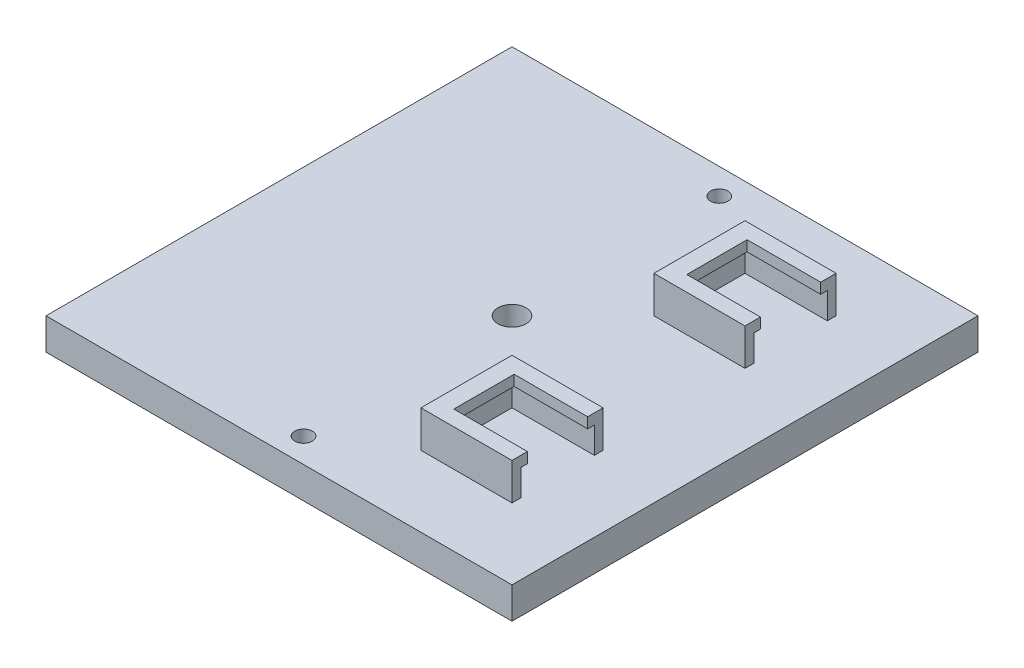
from build123d import *

# Parameters (mm, degrees)
SKETCH1_W            = 133
SKETCH1_H            = 133
BOSS_EXTRUDE2_DEPTH  = 136
SKETCH2_W            = 133
SKETCH2_H            = 118
CUT_EXTRUDE1_DEPTH   = 136
BOSS_EXTRUDE3_DEPTH  = 10.5
SKETCH5_W            = 21
SKETCH5_H            = 3
BOSS_EXTRUDE4_DEPTH  = 23.5
SKETCH6_W            = 42
SKETCH6_H            = 17.2
CUT_EXTRUDE2_DEPTH   = 3
BOSS_EXTRUDE5_DEPTH  = 10.5
SKETCH8_W            = 21
SKETCH8_H            = 3
BOSS_EXTRUDE6_DEPTH  = 23.5
SKETCH9_W            = 42
SKETCH9_H            = 17.2
CUT_EXTRUDE3_DEPTH   = 3
SKETCH10_W           = 19.261488562
SKETCH10_H           = 133
BOSS_EXTRUDE7_DEPTH  = 5
SKETCH11_W           = 18.43727499
SKETCH11_H           = 133
BOSS_EXTRUDE8_DEPTH  = 5
SKETCH12_W           = 18.849381776
SKETCH12_H           = 146
BOSS_EXTRUDE9_DEPTH  = 12
SKETCH14_W           = 18.849381776
SKETCH14_H           = 146
BOSS_EXTRUDE10_DEPTH = 12
SKETCH17_R           = 1
CUT_EXTRUDE4_DEPTH   = 222.251553667
SKETCH20_W           = 133.244561713
SKETCH20_H           = 5
CUT_EXTRUDE10_DEPTH  = 19
SKETCH21_W           = 157
SKETCH21_H           = 120.66580897
CUT_EXTRUDE11_DEPTH  = 118
SKETCH22_W           = 186.174267818
SKETCH22_H           = 42.2523161
CUT_EXTRUDE12_DEPTH  = 118
SKETCH23_W           = 12
SKETCH23_H           = 25.33419103
CUT_EXTRUDE13_DEPTH  = 118
SKETCH24_W           = 12
SKETCH24_H           = 25.33419103
CUT_EXTRUDE14_DEPTH  = 118
SKETCH31_R           = 2.5
CUT_EXTRUDE21_DEPTH  = 118
SKETCH32_R           = 2.5
CUT_EXTRUDE22_DEPTH  = 118
SKETCH33_W           = 133
SKETCH33_H           = 5
CUT_EXTRUDE24_DEPTH  = 118
SKETCH34_R           = 2.5
CUT_EXTRUDE25_DEPTH  = 118
SKETCH35_R           = 4
CUT_EXTRUDE26_DEPTH  = 10


with BuildPart() as part:
    # Sketch1 → Boss-Extrude2 (new body)
    with BuildSketch(Plane(origin=(0, 0, 0), x_dir=(1, 0, 0), z_dir=(0, 1, 0))):
        Rectangle(SKETCH1_W, SKETCH1_H)
    extrude(amount=BOSS_EXTRUDE2_DEPTH)

    # Sketch2 → Cut-Extrude1 (cut)
    with BuildSketch(Plane.XY.offset(66.5)):
        with Locations((0, 68)):
            Rectangle(SKETCH2_W, SKETCH2_H)
    extrude(amount=-CUT_EXTRUDE1_DEPTH, mode=Mode.SUBTRACT)


with BuildPart() as cut_extrude1_piece_1:
    # of the separate pieces the step leaves, piece 1, a body of its own (cut_extrude1_pieces)
    add(part.part.solids().sort_by_distance((-66.5, 0, 66.5))[0])

    # Sketch4 → Boss-Extrude3 (add)
    with BuildSketch(Plane(origin=(0, 9, 0), x_dir=(1, 0, 0), z_dir=(0, 1, 0))):
        Polygon((22.75, -22.75), (43.75, -22.75), (46.25, -22.75), (46.25, -20.25), (20.25, -20.25), (20.25, -46.25), (46.25, -46.25), (46.25, -43.75), (43.75, -43.75), (22.75, -43.75), align=None)
        Polygon((22.75, 43.75), (43.75, 43.75), (46.25, 43.75), (46.25, 46.25), (20.25, 46.25), (20.25, 20.25), (46.25, 20.25), (46.25, 22.75), (43.75, 22.75), (22.75, 22.75), align=None)
    extrude(amount=BOSS_EXTRUDE3_DEPTH)

    # Sketch5 → Boss-Extrude4 (add)
    with BuildSketch(Plane(origin=(22.75, 0, 0), x_dir=(0, 0, -1), z_dir=(1, 0, 0))):
        with Locations((-33.25, 18)):
            Rectangle(SKETCH5_W, SKETCH5_H)
        with Locations((33.25, 18)):
            Rectangle(SKETCH5_W, SKETCH5_H)
    extrude(amount=BOSS_EXTRUDE4_DEPTH)

    # Sketch6 → Cut-Extrude2 (cut)
    with BuildSketch(Plane(origin=(0, 19.5, 0), x_dir=(1, 0, 0), z_dir=(0, 1, 0))):
        with Locations((46.25, -33.25)):
            Rectangle(SKETCH6_W, SKETCH6_H)
        with Locations((46.25, 33.25)):
            Rectangle(SKETCH6_W, SKETCH6_H)
    extrude(amount=-CUT_EXTRUDE2_DEPTH, mode=Mode.SUBTRACT)

    # Sketch10 → Boss-Extrude7 (add)
    with BuildSketch(Plane.XZ):
        Rectangle(SKETCH10_W, SKETCH10_H)
    extrude(amount=BOSS_EXTRUDE7_DEPTH)



with BuildPart() as cut_extrude1_piece_2:
    # of the separate pieces the step leaves, piece 2, a body of its own (cut_extrude1_pieces)
    add(part.part.solids().sort_by_distance((66.5, 127, 66.5))[0])

    # Sketch7 → Boss-Extrude5 (add)
    with BuildSketch(Plane.XZ.offset(-127)):
        Polygon((-43.75, 43.75), (-22.75, 43.75), (-22.75, 22.75), (-43.75, 22.75), (-46.25, 22.75), (-46.25, 20.25), (-20.25, 20.25), (-20.25, 46.25), (-46.25, 46.25), (-46.25, 43.75), align=None)
        Polygon((-43.75, -22.75), (-22.75, -22.75), (-22.75, -43.75), (-43.75, -43.75), (-46.25, -43.75), (-46.25, -46.25), (-20.25, -46.25), (-20.25, -20.25), (-46.25, -20.25), (-46.25, -22.75), align=None)
    extrude(amount=BOSS_EXTRUDE5_DEPTH)

    # Sketch8 → Boss-Extrude6 (add)
    with BuildSketch(Plane.ZY.offset(22.75)):
        with Locations((33.25, 118)):
            Rectangle(SKETCH8_W, SKETCH8_H)
        with Locations((-33.25, 118)):
            Rectangle(SKETCH8_W, SKETCH8_H)
    extrude(amount=BOSS_EXTRUDE6_DEPTH)

    # Sketch9 → Cut-Extrude3 (cut)
    with BuildSketch(Plane.XZ.offset(-116.5)):
        with Locations((-46.25, 33.25)):
            Rectangle(SKETCH9_W, SKETCH9_H)
        with Locations((-46.25, -33.25)):
            Rectangle(SKETCH9_W, SKETCH9_H)
    extrude(amount=-CUT_EXTRUDE3_DEPTH, mode=Mode.SUBTRACT)

    # Sketch11 → Boss-Extrude8 (add)
    with BuildSketch(Plane(origin=(0, 136, 0), x_dir=(1, 0, 0), z_dir=(0, 1, 0))):
        Rectangle(SKETCH11_W, SKETCH11_H)
    extrude(amount=BOSS_EXTRUDE8_DEPTH)


with BuildPart() as cut_extrude1_piece_1_1:
    add(cut_extrude1_piece_1.part)

    add(cut_extrude1_piece_2.part)  # Boss-Extrude9 merges Cut-Extrude1 piece 2
    # Sketch12 → Boss-Extrude9 (add)
    with BuildSketch(Plane(origin=(0, 0, -66.5), x_dir=(-1, 0, 0), z_dir=(0, 0, -1))):
        with Locations((-0.206053393, 68)):
            Rectangle(SKETCH12_W, SKETCH12_H)
    extrude(amount=BOSS_EXTRUDE9_DEPTH)

    # Sketch14 → Boss-Extrude10 (add)
    with BuildSketch(Plane.XY.offset(66.5)):
        with Locations((0.206053393, 68)):
            Rectangle(SKETCH14_W, SKETCH14_H)
    extrude(amount=BOSS_EXTRUDE10_DEPTH)

    # Sketch17 → Cut-Extrude4 (cut, through all)
    with BuildSketch(Plane.XY.offset(78.5)):
        with Locations((0.206053393, 68)):
            Circle(SKETCH17_R)
    extrude(amount=-CUT_EXTRUDE4_DEPTH, mode=Mode.SUBTRACT)

    # Sketch20 → Cut-Extrude10 (cut)
    with BuildSketch(Plane.ZY.offset(9.218637495)):
        with Locations((0.122280857, 138.5)):
            Rectangle(SKETCH20_W, SKETCH20_H)
    extrude(amount=-CUT_EXTRUDE10_DEPTH, mode=Mode.SUBTRACT)

    # Sketch21 → Cut-Extrude11 (cut)
    with BuildSketch(Plane.ZY.offset(9.218637495)):
        with Locations((0, 80.667095515)):
            Rectangle(SKETCH21_W, SKETCH21_H)
    extrude(amount=-CUT_EXTRUDE11_DEPTH, mode=Mode.SUBTRACT)


with BuildPart() as cut_extrude11_piece_1:
    # of the separate pieces the step leaves, piece 1, a body of its own (cut_extrude11_pieces)
    add(cut_extrude1_piece_1_1.part.solids().sort_by_distance((9.630744281, 20.33419103, 66.5))[0])

    # Sketch23 → Cut-Extrude13 (cut)
    with BuildSketch(Plane.ZY.offset(9.218637495)):
        with Locations((-72.5, 7.667095515)):
            Rectangle(SKETCH23_W, SKETCH23_H)
    extrude(amount=-CUT_EXTRUDE13_DEPTH, mode=Mode.SUBTRACT)

    # Sketch24 → Cut-Extrude14 (cut)
    with BuildSketch(Plane.ZY.offset(9.218637495)):
        with Locations((72.5, 7.667095515)):
            Rectangle(SKETCH24_W, SKETCH24_H)
    extrude(amount=-CUT_EXTRUDE14_DEPTH, mode=Mode.SUBTRACT)

    # Sketch31 → Cut-Extrude21 (cut)
    with BuildSketch(Plane.XZ.offset(5)):
        with Locations(Location((0, 59.499471122, 0), (0, 0, 270))):
            Circle(SKETCH31_R)
    extrude(amount=-CUT_EXTRUDE21_DEPTH, mode=Mode.SUBTRACT)

    # Sketch32 → Cut-Extrude22 (cut)
    with BuildSketch(Plane.XZ.offset(5)):
        with Locations(Location((0, -59.159797643, 0), (0, 0, 270))):
            Circle(SKETCH32_R)
    extrude(amount=-CUT_EXTRUDE22_DEPTH, mode=Mode.SUBTRACT)

    # Sketch33 → Cut-Extrude24 (cut)
    with BuildSketch(Plane.ZY.offset(9.630744281)):
        with Locations((0, -2.5)):
            Rectangle(SKETCH33_W, SKETCH33_H)
    extrude(amount=-CUT_EXTRUDE24_DEPTH, mode=Mode.SUBTRACT)

    # Sketch34 → Cut-Extrude25 (cut)
    with BuildSketch(Plane(origin=(0, 9, 0), x_dir=(1, 0, 0), z_dir=(0, 1, 0))):
        with Locations(Location((0, 0, 0), (0, 0, 270))):
            Circle(SKETCH34_R)
    extrude(amount=-CUT_EXTRUDE25_DEPTH, mode=Mode.SUBTRACT)

    # Sketch35 → Cut-Extrude26 (cut)
    with BuildSketch(Plane(origin=(0, 9, 0), x_dir=(1, 0, 0), z_dir=(0, 1, 0))):
        with Locations(Location((0, 0, 0), (0, 0, 270))):
            Circle(SKETCH35_R)
    extrude(amount=-CUT_EXTRUDE26_DEPTH, mode=Mode.SUBTRACT)


with BuildPart() as cut_extrude11_piece_2:
    # of the separate pieces the step leaves, piece 2, a body of its own (cut_extrude11_pieces)
    add(cut_extrude1_piece_1_1.part.solids().sort_by_distance((-9.218637495, 127, 66.5))[0])

    # Sketch22 → Cut-Extrude12 (cut)
    with BuildSketch(Plane.ZY.offset(66.5)):
        with Locations((20.706035589, 120.536042421)):
            Rectangle(SKETCH22_W, SKETCH22_H)
    extrude(amount=-CUT_EXTRUDE12_DEPTH, mode=Mode.SUBTRACT)


solid = cut_extrude11_piece_1.part
